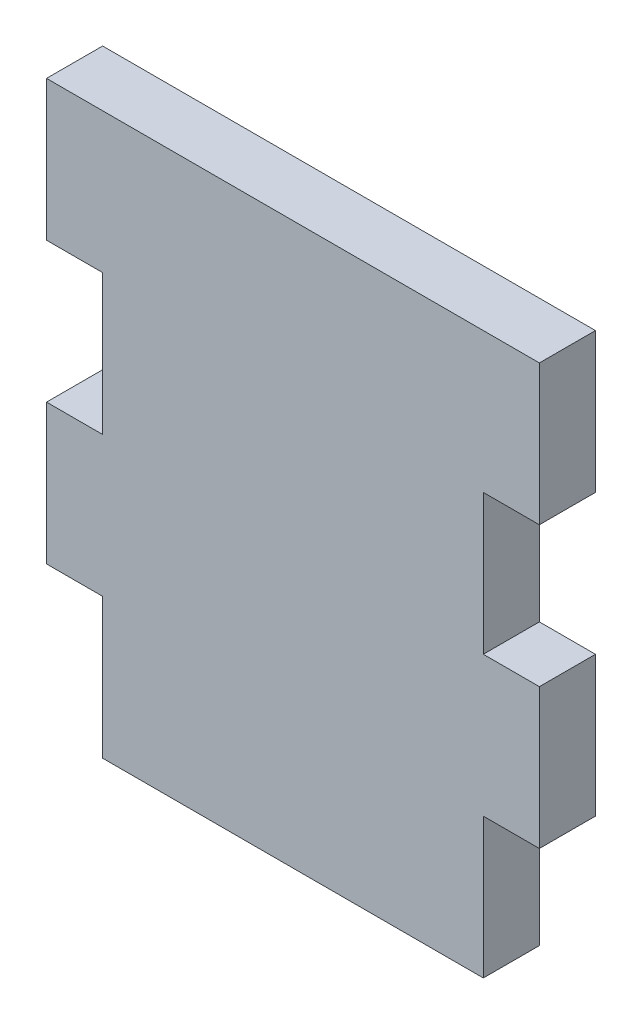
from build123d import *

# Parameters (mm, degrees)
SKETCH1_W           = 42.418
SKETCH1_H           = 48.26
BOSS_EXTRUDE1_DEPTH = 4.826
SKETCH2_W           = 4.826
SKETCH2_H           = 12.065
CUT_EXTRUDE1_DEPTH  = 95.596328561


with BuildPart() as part:
    # Sketch1 → Boss-Extrude1 (new body)
    with BuildSketch(Plane.XY):
        with Locations((-66.876249325, -10.019142782)):
            Rectangle(SKETCH1_W, SKETCH1_H)
    extrude(amount=BOSS_EXTRUDE1_DEPTH)

    # Sketch2 → Cut-Extrude1 (cut, through all)
    with BuildSketch(Plane.XY.offset(4.826)):
        with Locations((-85.672249325, -28.116642782)):
            Rectangle(SKETCH2_W, SKETCH2_H)
        with Locations((-85.672249325, -3.986642782)):
            Rectangle(SKETCH2_W, SKETCH2_H)
        with Locations((-48.080249325, -3.986642782)):
            Rectangle(SKETCH2_W, SKETCH2_H)
        with Locations((-48.080249325, -28.116642782)):
            Rectangle(SKETCH2_W, SKETCH2_H)
    extrude(amount=-CUT_EXTRUDE1_DEPTH, mode=Mode.SUBTRACT)


solid = part.part
